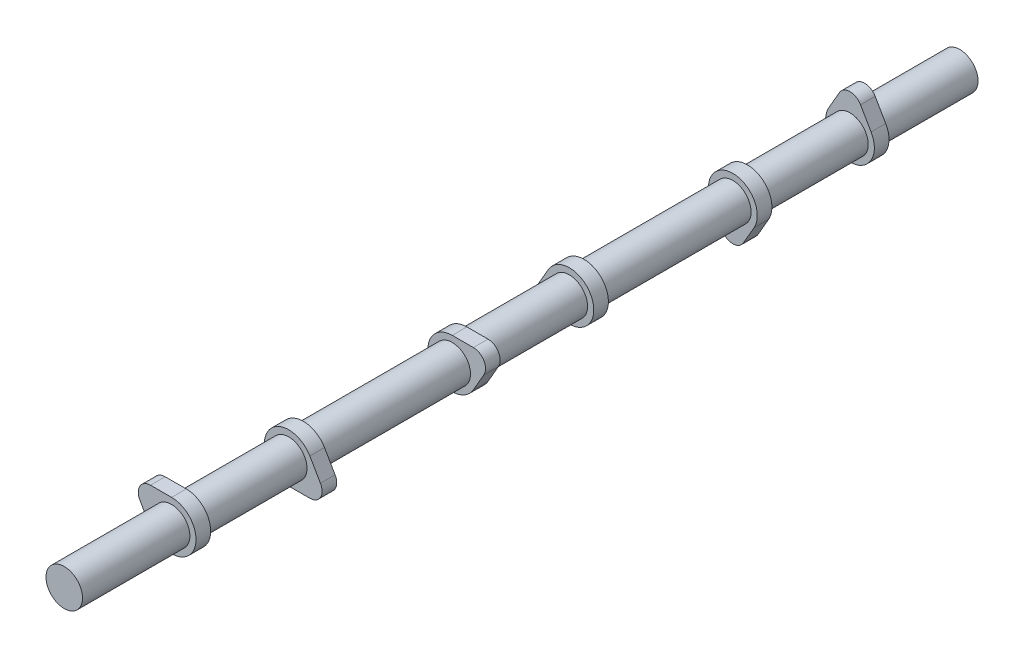
from build123d import *

# Parameters (mm, degrees)
BOSS_EXTRUDE1_DEPTH   = 3.81
LPATTERN1_COUNT       = 2
LPATTERN1_PITCH       = 60.96
BODY_MOVE_COPY1_ANGLE = 180
LPATTERN2_COUNT       = 3
LPATTERN2_PITCH       = 146.05
BODY_MOVE_COPY2_ANGLE = 120
BODY_MOVE_COPY3_ANGLE = 120
BOSS_EXTRUDE2_START   = 49.53
SKETCH2_R             = 9.5
BOSS_EXTRUDE2_DEPTH   = 466.09


with BuildPart() as part:
    # Sketch1 → Boss-Extrude1 (new, symmetric)
    with BuildSketch(Plane.XY):
        with BuildLine():
            Line((-5.499261314, 15.875), (-10.998522628, 6.35))
            ThreePointArc((-10.998522628, 6.35), (0, -12.7), (10.998522628, 6.35))
            Line((10.998522628, 6.35), (5.499261314, 15.875))
            ThreePointArc((5.499261314, 15.875), (0, 19.05), (-5.499261314, 15.875))
        make_face()
    extrude(amount=BOSS_EXTRUDE1_DEPTH, both=True)


with BuildPart() as lpattern1_1:
    # LPattern1: pattern copy
    add(part.part.moved(Location(Vector(0, 0, 1) * (1 * LPATTERN1_PITCH))))


with BuildPart() as lpattern1_1_1:
    # Body-Move/Copy1: moved
    add(lpattern1_1.part.rotate(Axis((0, 0, 0), (0, 0, 1)), BODY_MOVE_COPY1_ANGLE))


with BuildPart() as lpattern2_1:
    # LPattern2: pattern copy
    add(part.part.moved(Location(Vector(0, 0, 1) * (1 * LPATTERN2_PITCH))))


with BuildPart() as lpattern2_2:
    # LPattern2: pattern copy
    add(part.part.moved(Location(Vector(0, 0, 1) * (2 * LPATTERN2_PITCH))))


with BuildPart() as lpattern2_3:
    # LPattern2: pattern copy
    add(lpattern1_1_1.part.moved(Location(Vector(0, 0, 1) * (1 * LPATTERN2_PITCH))))


with BuildPart() as lpattern2_4:
    # LPattern2: pattern copy
    add(lpattern1_1_1.part.moved(Location(Vector(0, 0, 1) * (2 * LPATTERN2_PITCH))))


with BuildPart() as lpattern2_1_1:
    # Body-Move/Copy2: moved
    add(lpattern2_1.part.rotate(Axis((0, 0, 0), (0, 0, 1)), BODY_MOVE_COPY2_ANGLE))


with BuildPart() as lpattern2_3_1:
    # Body-Move/Copy2: moved
    add(lpattern2_3.part.rotate(Axis((0, 0, 0), (0, 0, 1)), BODY_MOVE_COPY2_ANGLE))


with BuildPart() as lpattern2_4_1:
    # Body-Move/Copy3: moved
    add(lpattern2_4.part.rotate(Axis((0, 0, 0), (0, 0, -1)), BODY_MOVE_COPY3_ANGLE))


with BuildPart() as lpattern2_2_1:
    # Body-Move/Copy3: moved
    add(lpattern2_2.part.rotate(Axis((0, 0, 0), (0, 0, -1)), BODY_MOVE_COPY3_ANGLE))


with BuildPart() as part_1:
    add(part.part)

    add(lpattern1_1_1.part)  # Boss-Extrude2 merges LPattern1_1

    add(lpattern2_1_1.part)  # Boss-Extrude2 merges LPattern2_1

    add(lpattern2_2_1.part)  # Boss-Extrude2 merges LPattern2_2

    add(lpattern2_3_1.part)  # Boss-Extrude2 merges LPattern2_3

    add(lpattern2_4_1.part)  # Boss-Extrude2 merges LPattern2_4
    # Sketch2 → Boss-Extrude2 (add)
    with BuildSketch(Plane(origin=(0, 0, -3.81), x_dir=(-1, 0, 0), z_dir=(0, 0, -1)).offset(BOSS_EXTRUDE2_START)):
        Circle(SKETCH2_R)
    extrude(amount=-BOSS_EXTRUDE2_DEPTH)


solid = part_1.part
